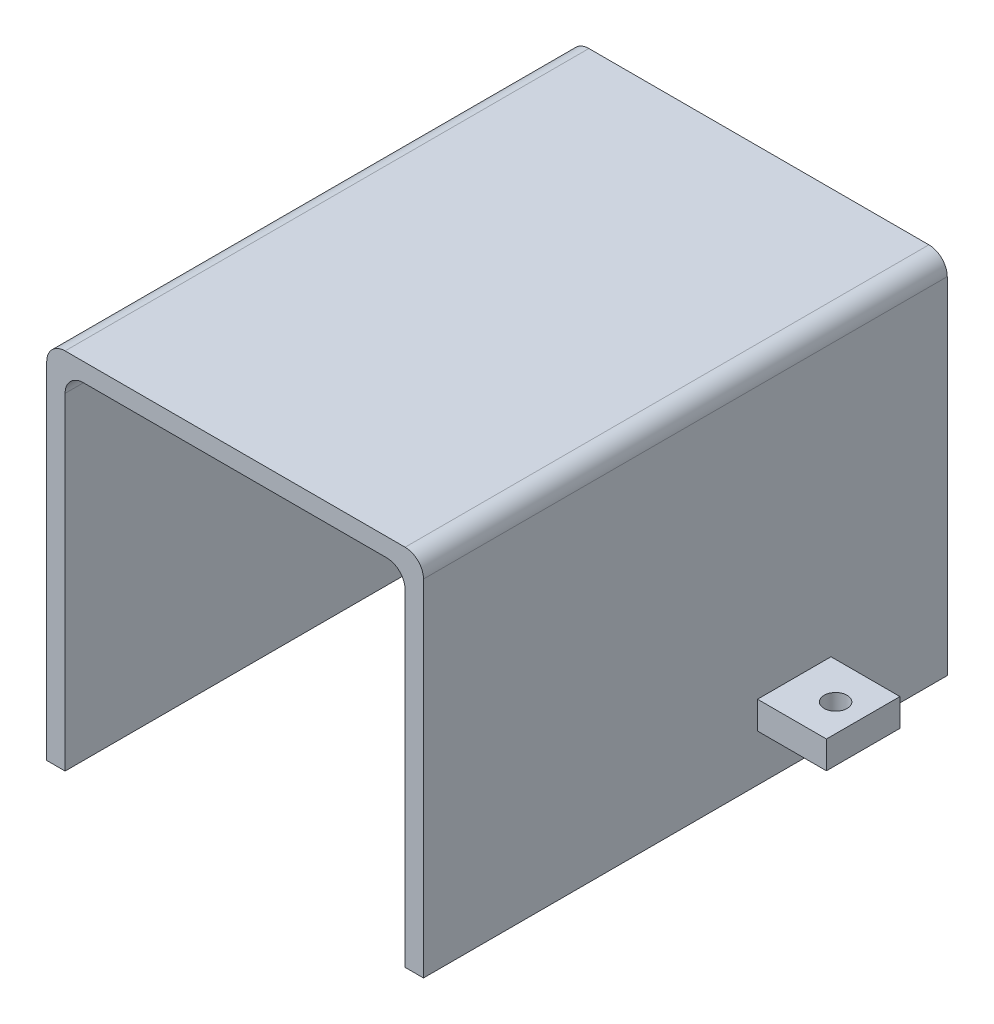
from build123d import *

# Parameters (mm, degrees)
BOSS_EXTRUDE1_DEPTH            = 40.35
BOSS_EXTRUDE1_DEPTH_BACK       = 16.65
SKETCH2_W                      = 7.5
SKETCH2_H                      = 8
SKETCH2_R                      = 0.5
BOSS_EXTRUDE2_DEPTH            = 3
BOSS_EXTRUDE2_2_DEPTH          = 3
FILLET1_R                      = 2
M3X0_5_TAPPED_HOLE1_AT_2_COUNT = 2
M3X0_5_TAPPED_HOLE1_AT_2_PITCH = 50


with BuildPart() as part:
    # Sketch1 → Boss-Extrude1 (new, two sides: drawn at the far end of the back side and taken through both)
    with BuildSketch(Plane.XY.offset(-BOSS_EXTRUDE1_DEPTH_BACK)):
        Polygon((-20.5, -13.6), (-20.5, 26), (20.5, 26), (20.5, -13.6), (18.5, -13.6), (18.5, 24), (-18.5, 24), (-18.5, -13.6), align=None)
    extrude(amount=BOSS_EXTRUDE1_DEPTH + BOSS_EXTRUDE1_DEPTH_BACK)

    # Fillet1
    fillet1_edges = [part.edges().sort_by_distance(p)[0] for p in [
        (18.5, 24, 11.85),
        (-18.5, 24, 11.85),
        (-20.5, 26, 11.85),
        (20.5, 26, 11.85),
    ]]
    fillet(fillet1_edges, radius=FILLET1_R)


with BuildPart() as body_2:
    # Sketch2 → Boss-Extrude2 (new body)
    with BuildSketch(Plane(origin=(0, -8.5, 0), x_dir=(-1, 0, 0), z_dir=(0, -1, 0))):
        with Locations((-24.25, 0)):
            Rectangle(SKETCH2_W, SKETCH2_H)
        with Locations(Location((-25, 0, 0), (0, 0, 90))):
            Circle(SKETCH2_R, mode=Mode.SUBTRACT)
    extrude(amount=-BOSS_EXTRUDE2_DEPTH)


with BuildPart() as body_3:
    # Sketch2 → Boss-Extrude2 2 (new body)
    with BuildSketch(Plane(origin=(0, -8.5, 0), x_dir=(-1, 0, 0), z_dir=(0, -1, 0))):
        with Locations((24.25, 0)):
            Rectangle(SKETCH2_W, SKETCH2_H)
        with Locations(Location((25, 0, 0), (0, 0, 270))):
            Circle(SKETCH2_R, mode=Mode.SUBTRACT)
    extrude(amount=-BOSS_EXTRUDE2_2_DEPTH)

    # Sketch5 → M3x0.5 Tapped Hole1 (revolve, cut)
    with BuildSketch(Plane(origin=(-25, -8.5, 0), x_dir=(0, 0, -1), z_dir=(1, 0, 0))):
        Polygon((0, 0), (0, 3.751075774), (1.25, 3), (1.25, 0), align=None)
    m3x0_5_tapped_hole1 = revolve(axis=Axis((-25, -14.85, 0), (0, 1, 0)), mode=Mode.SUBTRACT)


with BuildPart() as body_2_1:
    add(body_2.part)

    # M3x0.5 Tapped Hole1 at 2: M3x0.5 Tapped Hole1 ×2
    with Locations(*[(i * M3X0_5_TAPPED_HOLE1_AT_2_PITCH, 0, 0) for i in range(1, M3X0_5_TAPPED_HOLE1_AT_2_COUNT)]):
        add(m3x0_5_tapped_hole1, mode=Mode.SUBTRACT)


solid = Compound([part.part, body_3.part, body_2_1.part])
